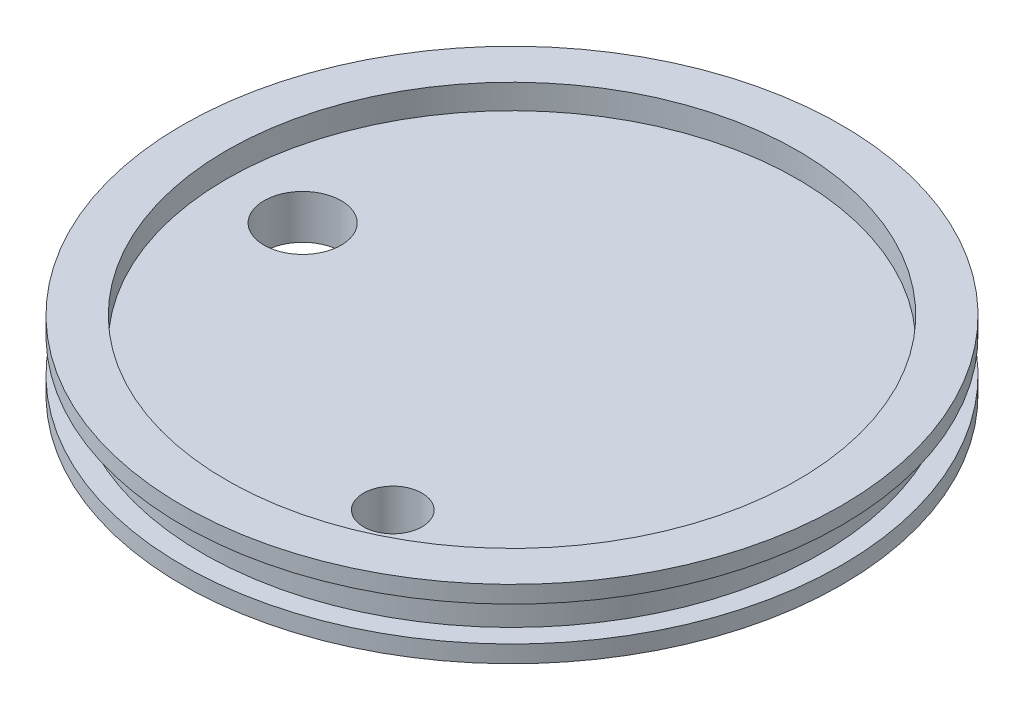
from build123d import *

# Parameters (mm, degrees)
PIPE_TAP_DRILL_FOR_1_4_TAP1_D = 11.1252
PIPE_TAP_DRILL_FOR_1_8_TAP1_D = 8.4328
SKETCH6_R                     = 6.35
BOSS_EXTRUDE1_DEPTH           = 6.35


with BuildPart() as part:
    # Sketch1 → Revolve1 (revolve)
    with BuildSketch(Plane.XY, mode=Mode.PRIVATE) as revolve1_sk:
        Polygon((0, 0), (47.498, 0), (47.498, 2.4638), (44.577, 2.4638), (44.577, 7.4422), (47.498, 7.4422), (47.498, 9.906), (41.148, 9.906), (41.148, 6.35), (0, 6.35), align=None)
    revolve(revolve1_sk.sketch.rotate(Axis((0, 48.192213231, 0), (0, -1, 0)), 180), axis=Axis((0, 48.192213231, 0), (0, -1, 0)))

    # Pipe Tap Drill for 1/4 Tap1 (through all)
    with Locations(Plane(origin=(0, 6.35, 0), x_dir=(1, 0, 0), z_dir=(0, 1, 0))):
        with Locations((0, 0), (-30.1752, 0)):
            Hole(PIPE_TAP_DRILL_FOR_1_4_TAP1_D / 2)

    # Pipe Tap Drill for 1/8 Tap1 (through all)
    with Locations(Plane(origin=(0, 6.35, 0), x_dir=(1, 0, 0), z_dir=(0, 1, 0))):
        with Locations((12.150198978, -29.333175157)):
            Hole(PIPE_TAP_DRILL_FOR_1_8_TAP1_D / 2)

    # Sketch6 → Boss-Extrude1 (add)
    with BuildSketch(Plane(origin=(0, 6.35, 0), x_dir=(1, 0, 0), z_dir=(0, 1, 0))):
        Circle(SKETCH6_R)
    extrude(amount=-BOSS_EXTRUDE1_DEPTH)


solid = part.part
